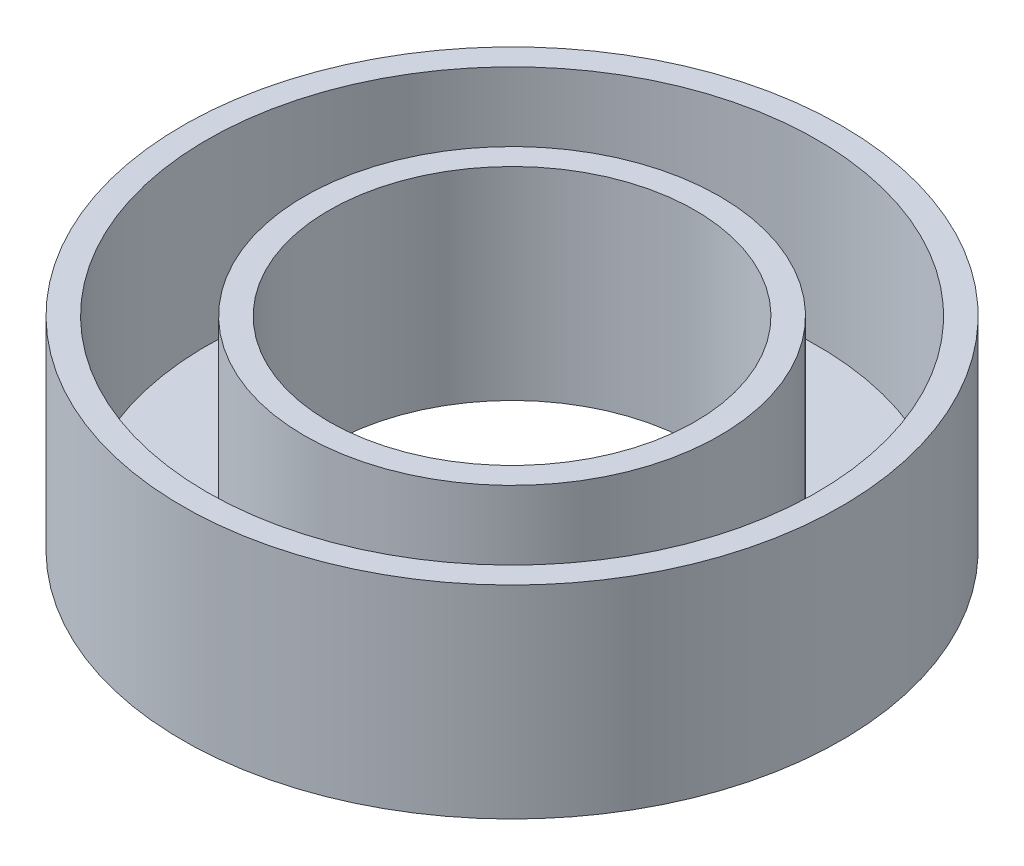
from build123d import *

# Parameters (mm, degrees)
SKETCH1_R            = 13.5
MAIN_EXTRUSION_DEPTH = 8.3
SKETCH2_R            = 7.5
ID_BORE_DEPTH        = 20
SKETCH3_R            = 12.5
SKETCH3_R_2          = 8.5
SEAL_RECESS_DEPTH    = 7.3


with BuildPart() as part:
    # Sketch1 → main extrusion (new body)
    with BuildSketch(Plane(origin=(0, 0, 0), x_dir=(1, 0, 0), z_dir=(0, 1, 0))):
        with Locations(Location((0, 0, 0), (0, 0, 90))):
            Circle(SKETCH1_R)
    extrude(amount=MAIN_EXTRUSION_DEPTH)

    # Sketch2 → ID bore (cut)
    with BuildSketch(Plane(origin=(0, 8.3, 0), x_dir=(1, 0, 0), z_dir=(0, 1, 0))):
        with Locations(Location((0, 0, 0), (0, 0, 270))):
            Circle(SKETCH2_R)
    extrude(amount=-ID_BORE_DEPTH, mode=Mode.SUBTRACT)

    # Sketch3 → seal recess (cut)
    with BuildSketch(Plane(origin=(0, 8.3, 0), x_dir=(1, 0, 0), z_dir=(0, 1, 0))):
        with Locations(Location((0, 0, 0), (0, 0, 270))):
            Circle(SKETCH3_R)
        with Locations(Location((0, 0, 0), (0, 0, 270))):
            Circle(SKETCH3_R_2, mode=Mode.SUBTRACT)
    extrude(amount=-SEAL_RECESS_DEPTH, mode=Mode.SUBTRACT)


solid = part.part
